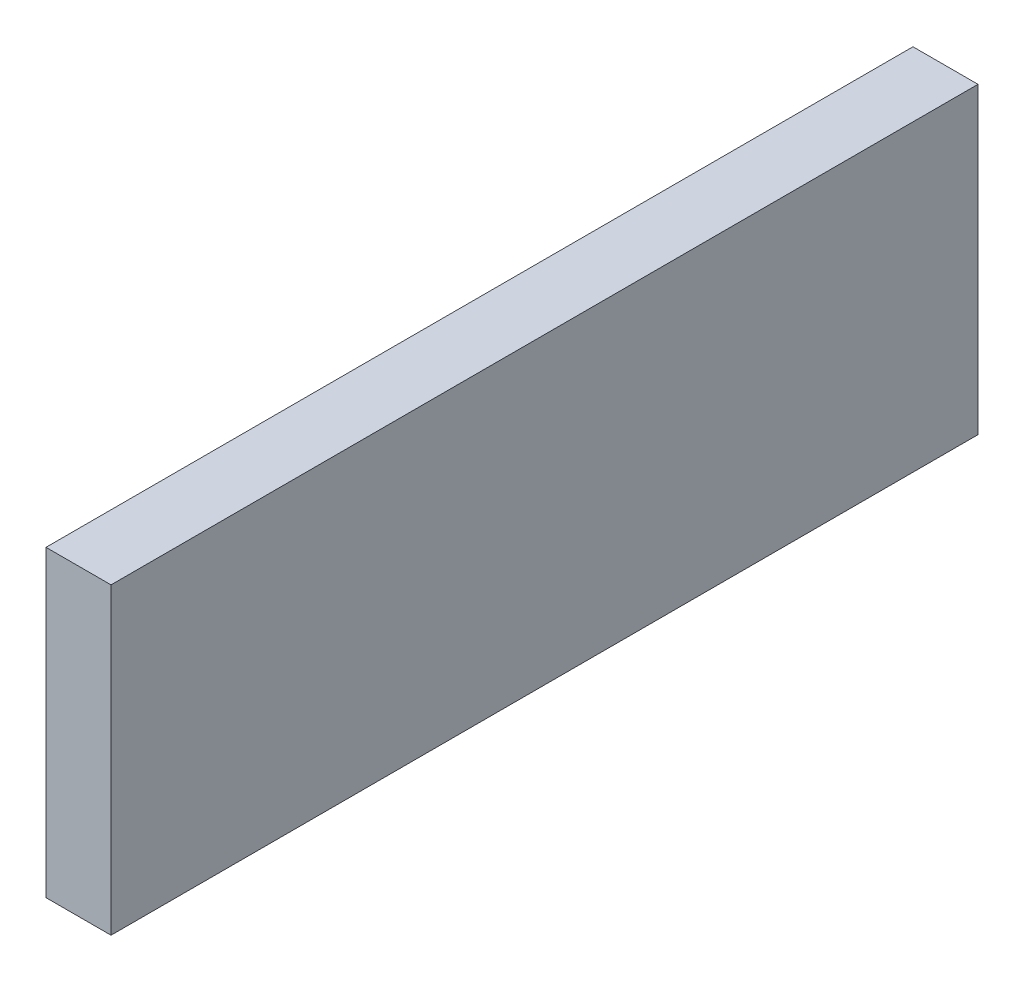
from build123d import *

# Parameters (mm, degrees)
SKETCH1_W           = 40
SKETCH1_H           = 14
BOSS_EXTRUDE1_DEPTH = 3


with BuildPart() as part:
    # Sketch1 → Boss-Extrude1 (new body)
    with BuildSketch(Plane(origin=(0, 0, 0), x_dir=(0, 0, -1), z_dir=(1, 0, 0))):
        Rectangle(SKETCH1_W, SKETCH1_H)
    extrude(amount=BOSS_EXTRUDE1_DEPTH)


solid = part.part
